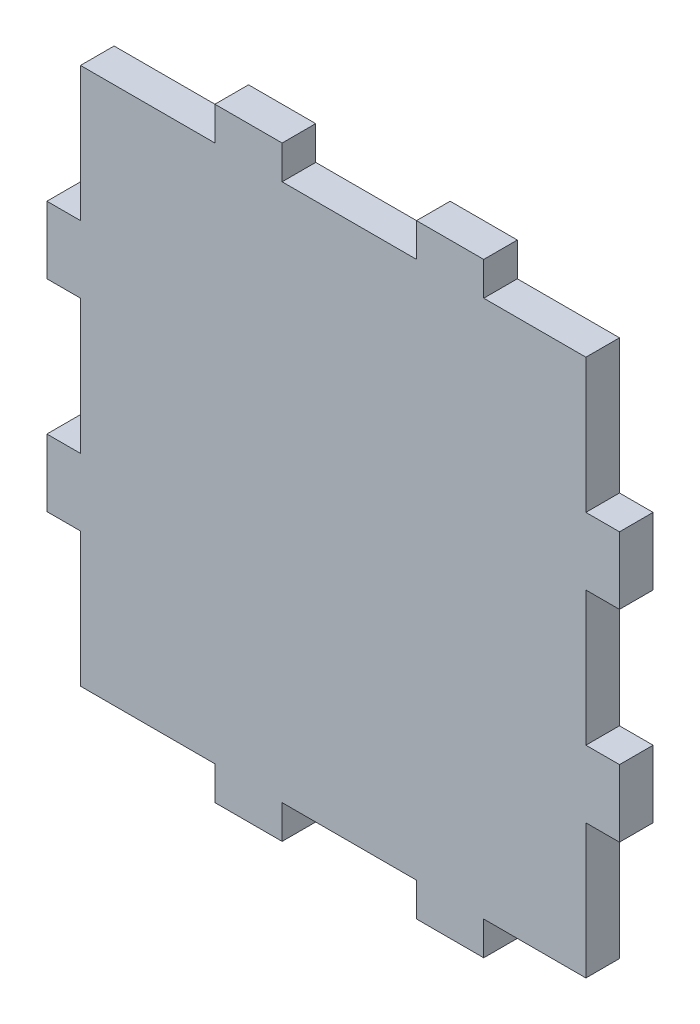
from build123d import *

# Parameters (mm, degrees)
BOSS_EXTRUDE1_DEPTH = 3.175


with BuildPart() as part:
    # Sketch1 → Boss-Extrude1 (new body)
    with BuildSketch(Plane.XY):
        Polygon((19.05, 0), (31.75, 0), (31.75, 3.175), (38.1, 3.175), (38.1, 0), (47.752, 0), (47.752, -12.7), (50.927, -12.7), (50.927, -19.05), (47.752, -19.05), (47.752, -31.75), (50.927, -31.75), (50.927, -38.1), (47.752, -38.1), (47.752, -50.8), (38.1, -50.8), (38.1, -53.975), (31.75, -53.975), (31.75, -50.8), (19.05, -50.8), (19.05, -53.975), (12.7, -53.975), (12.7, -50.8), (0, -50.8), (0, -38.1), (-3.175, -38.1), (-3.175, -31.75), (0, -31.75), (0, -19.05), (-3.175, -19.05), (-3.175, -12.7), (0, -12.7), (0, 0), (12.7, 0), (12.7, 3.175), (19.05, 3.175), align=None)
    extrude(amount=BOSS_EXTRUDE1_DEPTH)


solid = part.part
